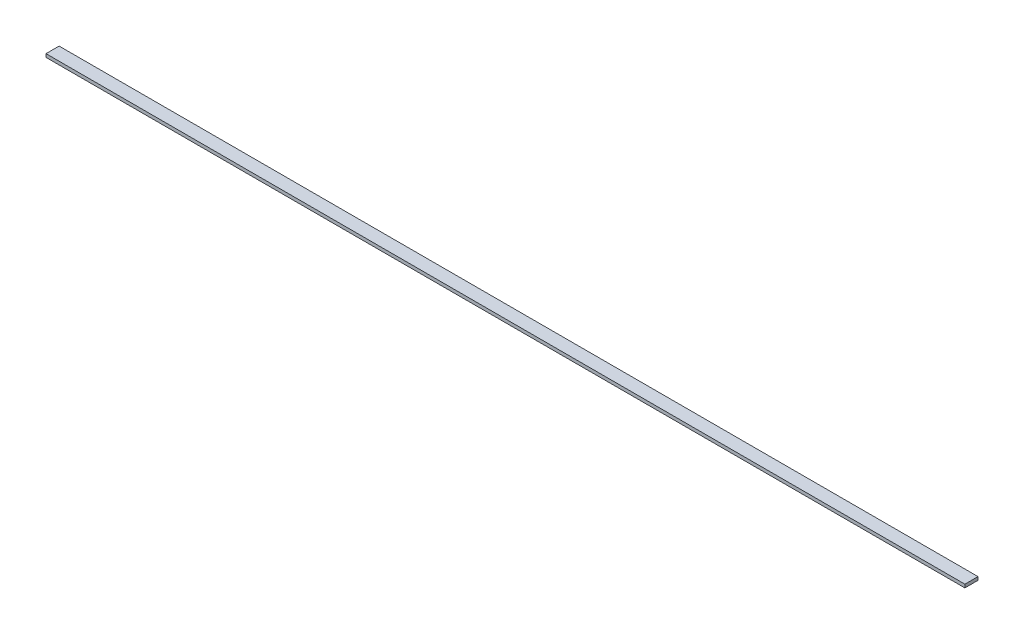
from build123d import *

# Parameters (mm, degrees)
SKETCH1_W           = 1778
SKETCH1_H           = 25.4
BOSS_EXTRUDE1_DEPTH = 6.35


with BuildPart() as part:
    # Sketch1 → Boss-Extrude1 (new body)
    with BuildSketch(Plane(origin=(0, 0, 0), x_dir=(1, 0, 0), z_dir=(0, 1, 0))):
        Rectangle(SKETCH1_W, SKETCH1_H)
    extrude(amount=BOSS_EXTRUDE1_DEPTH)


solid = part.part
